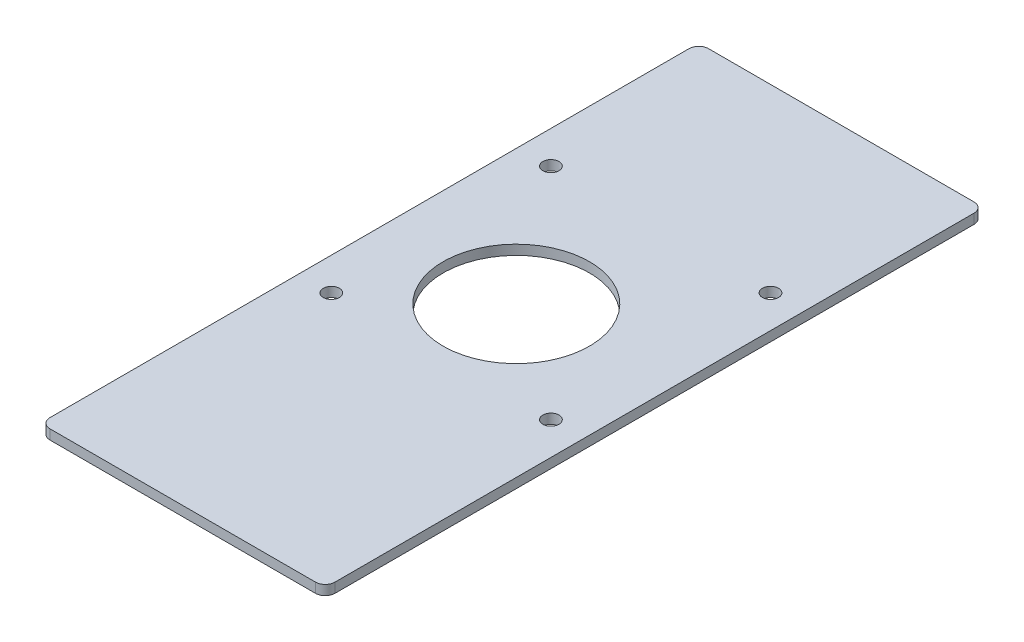
from build123d import *

# Parameters (mm, degrees)
SKETCH1_W           = 58.4
SKETCH1_H           = 134.95
BOSS_EXTRUDE1_DEPTH = 2
FILLET1_R           = 2
SKETCH2_R           = 1.65
CUT_EXTRUDE1_DEPTH  = 101.736235674
SKETCH3_R           = 15
CUT_EXTRUDE2_DEPTH  = 101.736235674


with BuildPart() as part:
    # Sketch1 → Boss-Extrude1 (new body)
    with BuildSketch(Plane(origin=(0, 0, 0), x_dir=(1, 0, 0), z_dir=(0, 1, 0))):
        with Locations((-17.49012047, -21.765247804)):
            Rectangle(SKETCH1_W, SKETCH1_H)
    extrude(amount=BOSS_EXTRUDE1_DEPTH)

    # Fillet1
    fillet1_edges = [part.edges().sort_by_distance(p)[0] for p in [
        (-46.69012047, 1, -45.709752196),
        (11.70987953, 1, -45.709752196),
        (11.70987953, 1, 89.240247804),
        (-46.69012047, 1, 89.240247804),
    ]]
    fillet(fillet1_edges, radius=FILLET1_R)

    # Sketch2 → Cut-Extrude1 (cut, through all)
    with BuildSketch(Plane(origin=(0, 2, 0), x_dir=(1, 0, 0), z_dir=(0, 1, 0))):
        with Locations(Location((-39.99012047, 8.709752196, 0), (0, 0, 270))):
            Circle(SKETCH2_R)
        with Locations(Location((5.00987953, 8.709752196, 0), (0, 0, 270))):
            Circle(SKETCH2_R)
        with Locations(Location((5.00987953, -36.290247804, 0), (0, 0, 270))):
            Circle(SKETCH2_R)
        with Locations(Location((-39.99012047, -36.290247804, 0), (0, 0, 270))):
            Circle(SKETCH2_R)
    extrude(amount=-CUT_EXTRUDE1_DEPTH, mode=Mode.SUBTRACT)

    # Sketch3 → Cut-Extrude2 (cut, through all)
    with BuildSketch(Plane(origin=(0, 2, 0), x_dir=(1, 0, 0), z_dir=(0, 1, 0))):
        with Locations(Location((-19.084532275, -19.290247804, 0), (0, 0, 270))):
            Circle(SKETCH3_R)
    extrude(amount=-CUT_EXTRUDE2_DEPTH, mode=Mode.SUBTRACT)


solid = part.part
